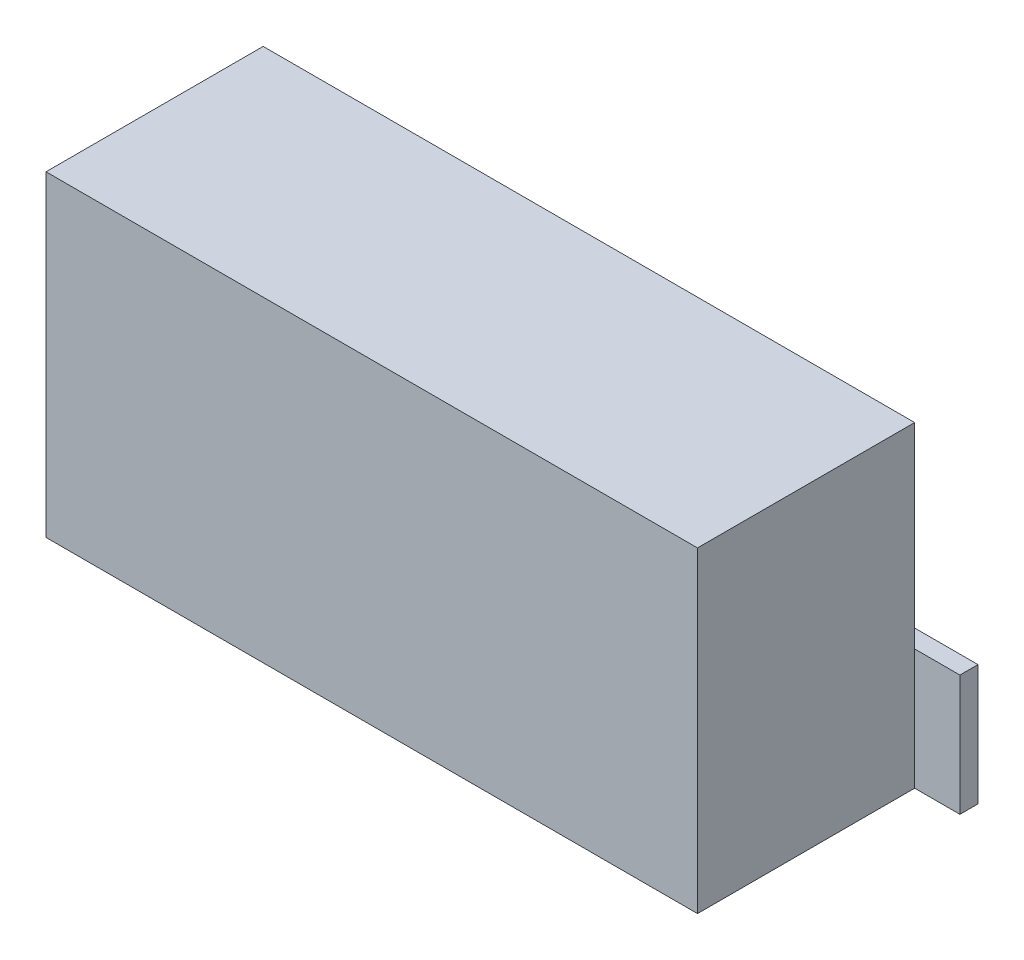
from build123d import *

# Parameters (mm, degrees)
SKETCH_1_W      = 108
SKETCH_1_H      = 36
EXTRUDE_1_DEPTH = 52.5
SKETCH_2_W      = 15
SKETCH_2_H      = 20
EXTRUDE_2_DEPTH = 3


with BuildPart() as part:
    # 草图1 → 凸台-拉伸1 (new body)
    with BuildSketch(Plane(origin=(0, 0, 0), x_dir=(1, 0, 0), z_dir=(0, 1, 0))):
        Rectangle(SKETCH_1_W, SKETCH_1_H)
    extrude(amount=EXTRUDE_1_DEPTH)

    # 草图2 → 凸台-拉伸2 (add)
    with BuildSketch(Plane(origin=(0, 0, -18), x_dir=(-1, 0, 0), z_dir=(0, 0, -1))):
        with Locations((-54, 10)):
            Rectangle(SKETCH_2_W, SKETCH_2_H)
    extrude(amount=EXTRUDE_2_DEPTH)


solid = part.part
